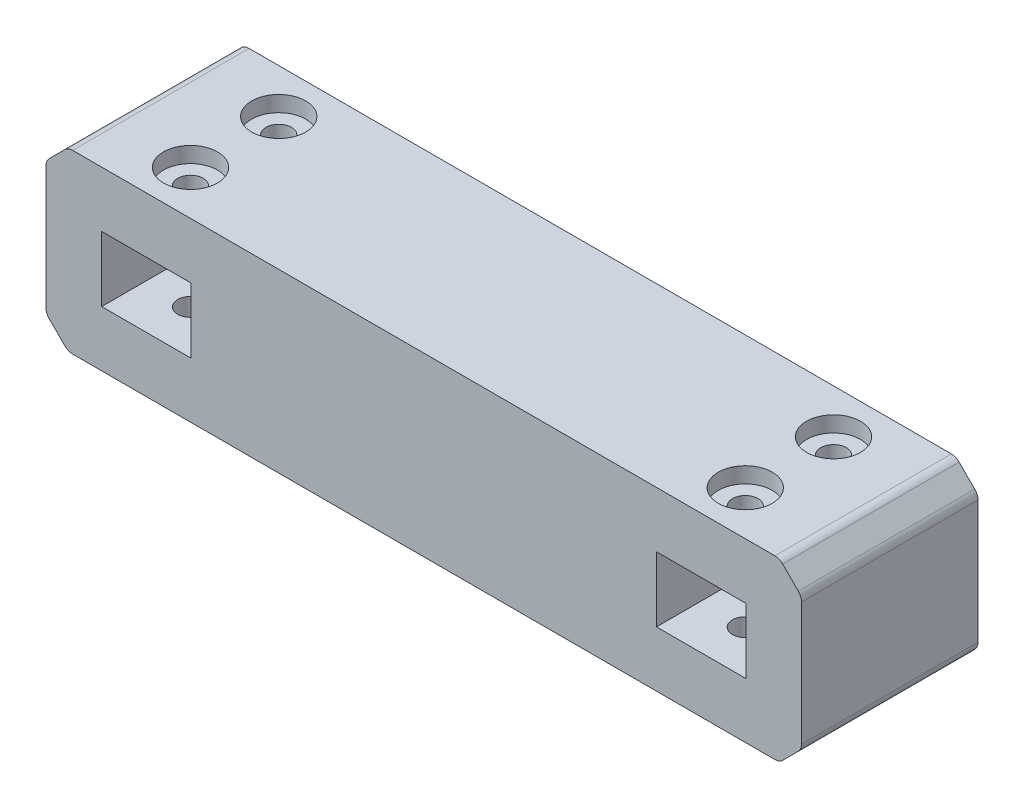
from build123d import *

# Parameters (mm, degrees)
SKETCH2_W                               = 171.25
SKETCH2_H                               = 40
BOSS_EXTRUDE1_DEPTH                     = 40
SKETCH3_W                               = 20.25
SKETCH3_H                               = 14.75
CUT_EXTRUDE1_DEPTH                      = 97.600417313
CHAMFER1_SIZE                           = 5
FILLET1_R                               = 2.5
CBORE_FOR_M5_HEX_HEAD_BOLT1_D           = 5.8
CBORE_FOR_M5_HEX_HEAD_BOLT1_CBORE_D     = 12.24
CBORE_FOR_M5_HEX_HEAD_BOLT1_CBORE_DEPTH = 3.58
MIRROR2_COPY_1_D                        = 5.8
MIRROR2_COPY_1_CBORE_D                  = 12.24
MIRROR2_COPY_1_CBORE_DEPTH              = 3.58


with BuildPart() as part:
    # Sketch2 → Boss-Extrude1 (new body)
    with BuildSketch(Plane.XY):
        Rectangle(SKETCH2_W, SKETCH2_H)
    extrude(amount=BOSS_EXTRUDE1_DEPTH)

    # Sketch3 → Cut-Extrude1 (cut, through all)
    with BuildSketch(Plane.XY.offset(40)):
        with Locations((-62.875, 0)):
            Rectangle(SKETCH3_W, SKETCH3_H)
        with Locations((62.875, 0)):
            Rectangle(SKETCH3_W, SKETCH3_H)
    extrude(amount=-CUT_EXTRUDE1_DEPTH, mode=Mode.SUBTRACT)

    # Chamfer1
    chamfer1_edges = [part.edges().sort_by_distance(p)[0] for p in [
        (85.625, -20, 20),
        (-85.625, -20, 20),
        (-85.625, 20, 20),
        (85.625, 20, 20),
    ]]
    chamfer(chamfer1_edges, length=CHAMFER1_SIZE)

    # Fillet1
    fillet1_edges = [part.edges().sort_by_distance(p)[0] for p in [
        (-80.625, 20, 20),
        (80.625, 20, 20),
        (85.625, -15, 20),
        (85.625, 15, 20),
        (-80.625, -20, 20),
        (80.625, -20, 20),
        (-85.625, 15, 20),
        (-85.625, -15, 20),
    ]]
    fillet(fillet1_edges, radius=FILLET1_R)

    # CBORE for M5 Hex Head Bolt1 (through all)
    with Locations(Plane(origin=(0, 20, 0), x_dir=(1, 0, 0), z_dir=(0, 1, 0))):
        with Locations((-62.875, -10)):
            cbore_for_m5_hex_head_bolt1 = CounterBoreHole(CBORE_FOR_M5_HEX_HEAD_BOLT1_D / 2, CBORE_FOR_M5_HEX_HEAD_BOLT1_CBORE_D / 2, CBORE_FOR_M5_HEX_HEAD_BOLT1_CBORE_DEPTH)

    # Mirror1: CBORE for M5 Hex Head Bolt1 across plane
    add(cbore_for_m5_hex_head_bolt1.mirror(Plane.XY.offset(20)), mode=Mode.SUBTRACT)

    # Mirror2: CBORE for M5 Hex Head Bolt1 across plane
    add(cbore_for_m5_hex_head_bolt1.mirror(Plane(origin=(0, 0, 0), x_dir=(0, 0, 1), z_dir=(1, 0, 0))), mode=Mode.SUBTRACT)

    # Mirror2 copy 1 (through all)
    with Locations(Plane(origin=(0, 20, 40), x_dir=(-1, 0, 0), z_dir=(0, 1, 0))):
        with Locations((-62.875, -10)):
            CounterBoreHole(MIRROR2_COPY_1_D / 2, MIRROR2_COPY_1_CBORE_D / 2, MIRROR2_COPY_1_CBORE_DEPTH)


solid = part.part
